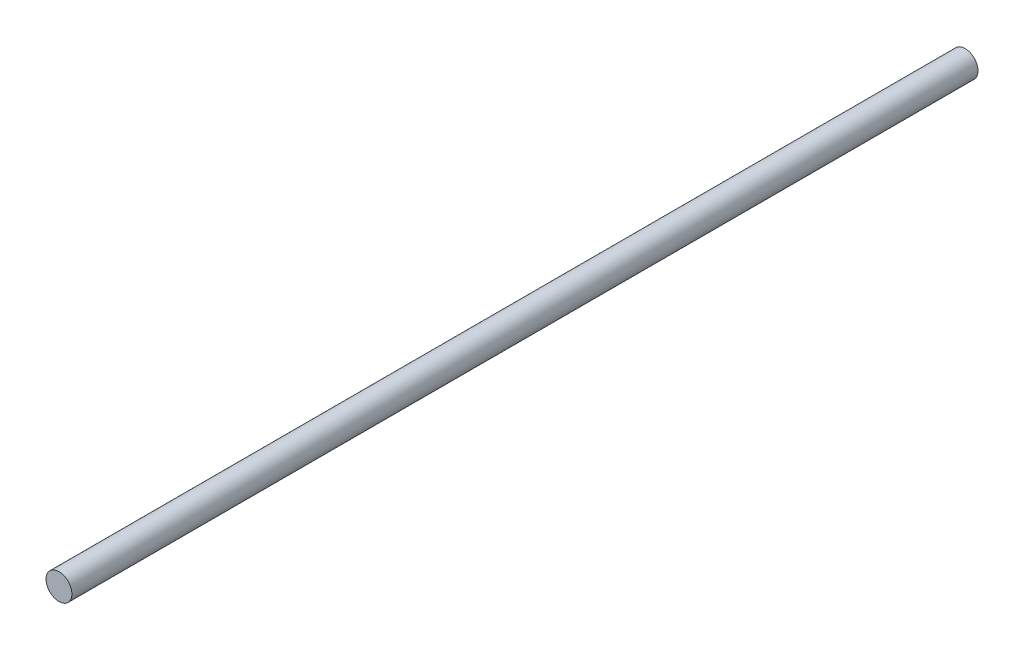
from build123d import *

# Parameters (mm, degrees)
SKETCH1_W = 1.5
SKETCH1_H = 105


with BuildPart() as part:
    # Sketch1 → Revolve1 (revolve)
    with BuildSketch(Plane.XZ, mode=Mode.PRIVATE) as revolve1_sk:
        with Locations((0.75, 52.5)):
            Rectangle(SKETCH1_W, SKETCH1_H)
    revolve(revolve1_sk.sketch.rotate(Axis((0, 0, 105), (0, 0, -1)), 180), axis=Axis((0, 0, 105), (0, 0, -1)))


solid = part.part
